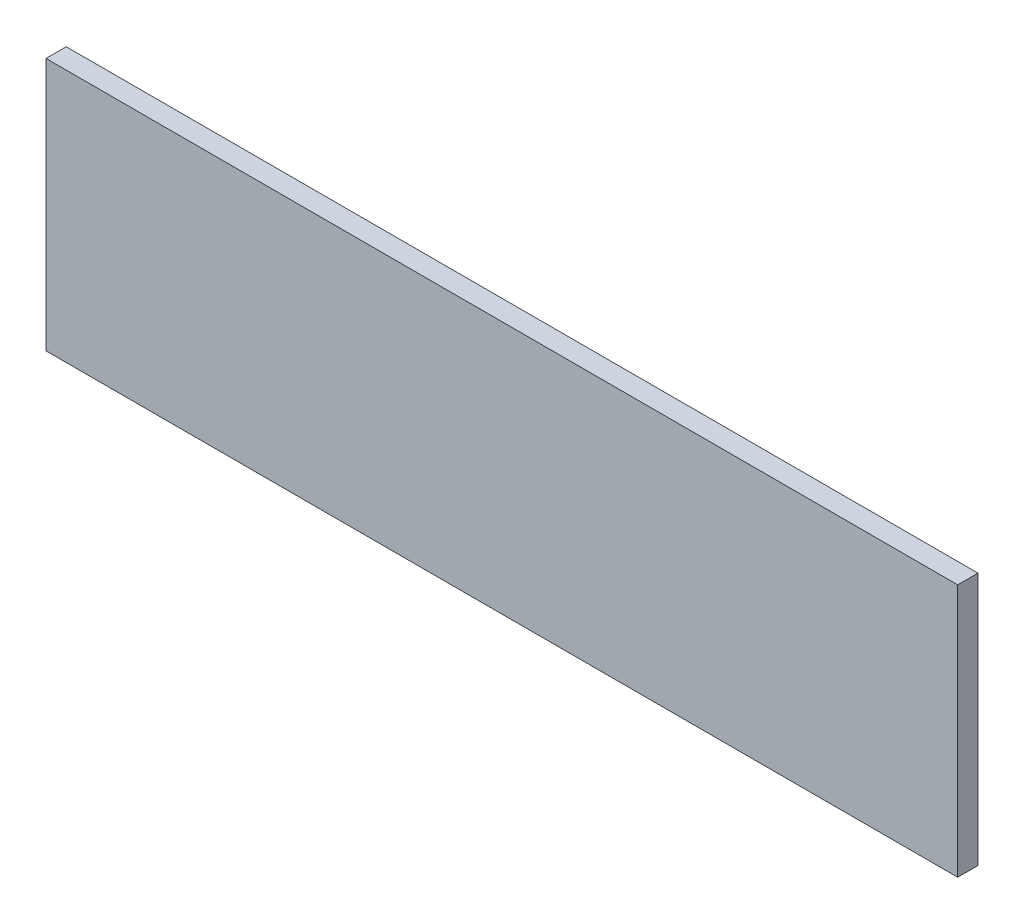
from build123d import *

# Parameters (mm, degrees)
SKETCH1_W           = 90
SKETCH1_H           = 25
BOSS_EXTRUDE1_DEPTH = 2


with BuildPart() as part:
    # Sketch1 → Boss-Extrude1 (new body)
    with BuildSketch(Plane.XY):
        Rectangle(SKETCH1_W, SKETCH1_H)
    extrude(amount=BOSS_EXTRUDE1_DEPTH)


solid = part.part
